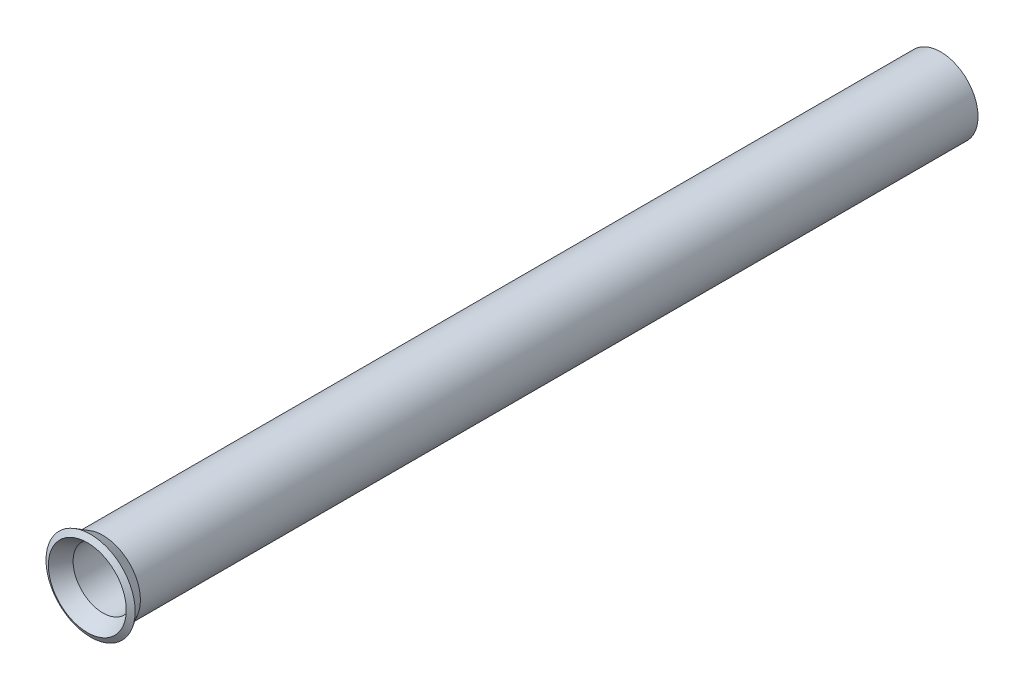
from build123d import *

# Parameters (mm, degrees)
SKETCH1_R           = 1.5875
SKETCH1_R_2         = 1.27
BOSS_EXTRUDE1_DEPTH = 35.56


with BuildPart() as part:
    # Sketch1 → Boss-Extrude1 (new body)
    with BuildSketch(Plane.XY):
        Circle(SKETCH1_R)
        Circle(SKETCH1_R_2, mode=Mode.SUBTRACT)
    extrude(amount=BOSS_EXTRUDE1_DEPTH)

    # Sketch2 → Revolve1 (revolve)
    with BuildSketch(Plane(origin=(0, 0, 0), x_dir=(1, 0, 0), z_dir=(0, 1, 0)), mode=Mode.PRIVATE) as revolve1_sk:
        Polygon((1.5875, -35.56), (1.8923, -36.087929086), (1.654175, -36.225410619), (1.27, -35.56), align=None)
    revolve(revolve1_sk.sketch.rotate(Axis((0, 0, 35.56), (0, 0, 1)), 180), axis=Axis((0, 0, 35.56), (0, 0, 1)))


solid = part.part
